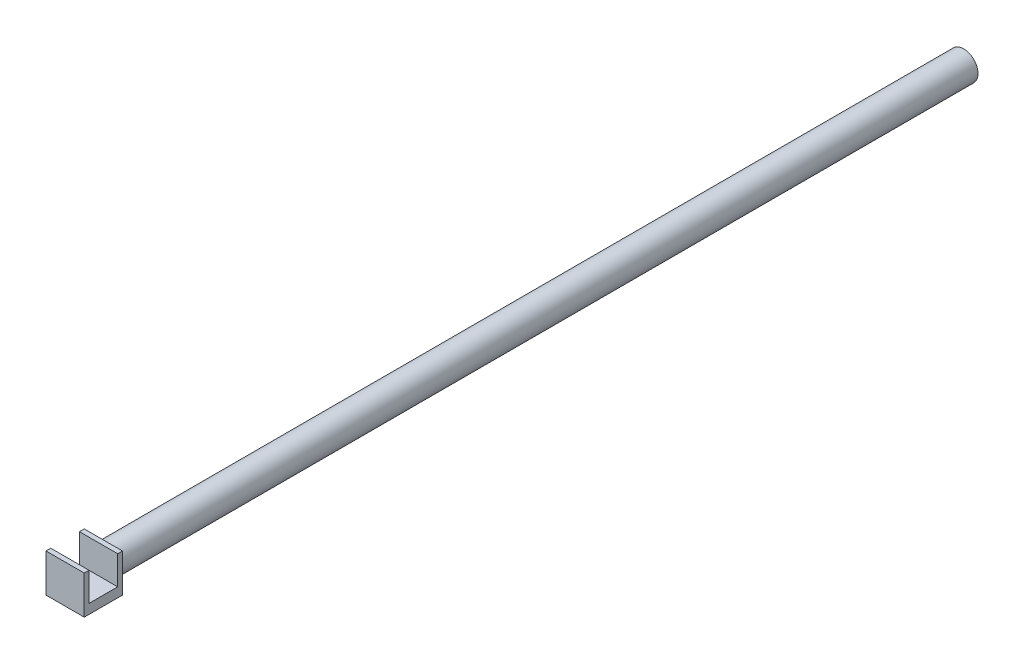
from build123d import *

# Parameters (mm, degrees)
BOSS_EXTRUDE1_DEPTH = 10
SKETCH4_R           = 7.5
BOSS_EXTRUDE2_DEPTH = 450


with BuildPart() as part:
    # Sketch2 → Boss-Extrude1 (new, symmetric)
    with BuildSketch(Plane(origin=(0, 0, 0), x_dir=(0, 0, -1), z_dir=(1, 0, 0))):
        Polygon((7.5, 7.5), (10, 7.5), (10, -12.5), (-10, -12.5), (-10, 7.5), (-7.5, 7.5), (-7.5, -7.5), (7.5, -7.5), align=None)
    extrude(amount=BOSS_EXTRUDE1_DEPTH, both=True)

    # Sketch4 → Boss-Extrude2 (add)
    with BuildSketch(Plane(origin=(0, 0, -10), x_dir=(-1, 0, 0), z_dir=(0, 0, -1))):
        with Locations(Location((0, -2.5, 0), (0, 0, 90))):
            Circle(SKETCH4_R)
    extrude(amount=BOSS_EXTRUDE2_DEPTH)


solid = part.part
